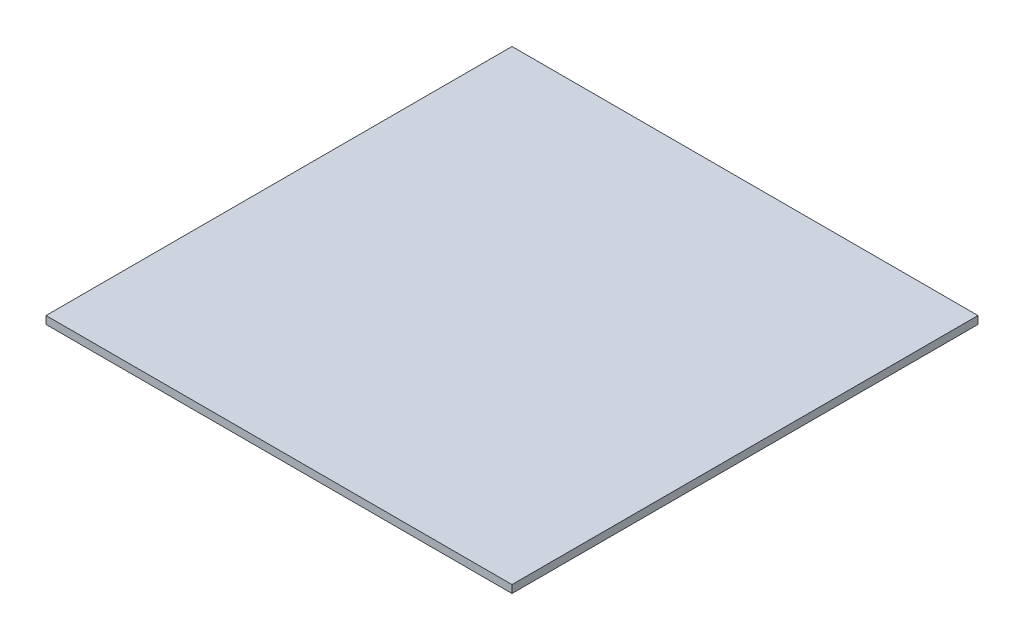
from build123d import *

# Parameters (mm, degrees)
SKETCH_1_W      = 600
SKETCH_1_H      = 600
EXTRUDE_1_DEPTH = 10


with BuildPart() as part:
    # 草图1 → 凸台-拉伸1 (new body)
    with BuildSketch(Plane(origin=(0, 0, 0), x_dir=(1, 0, 0), z_dir=(0, 1, 0))):
        Rectangle(SKETCH_1_W, SKETCH_1_H)
    extrude(amount=EXTRUDE_1_DEPTH)


solid = part.part
